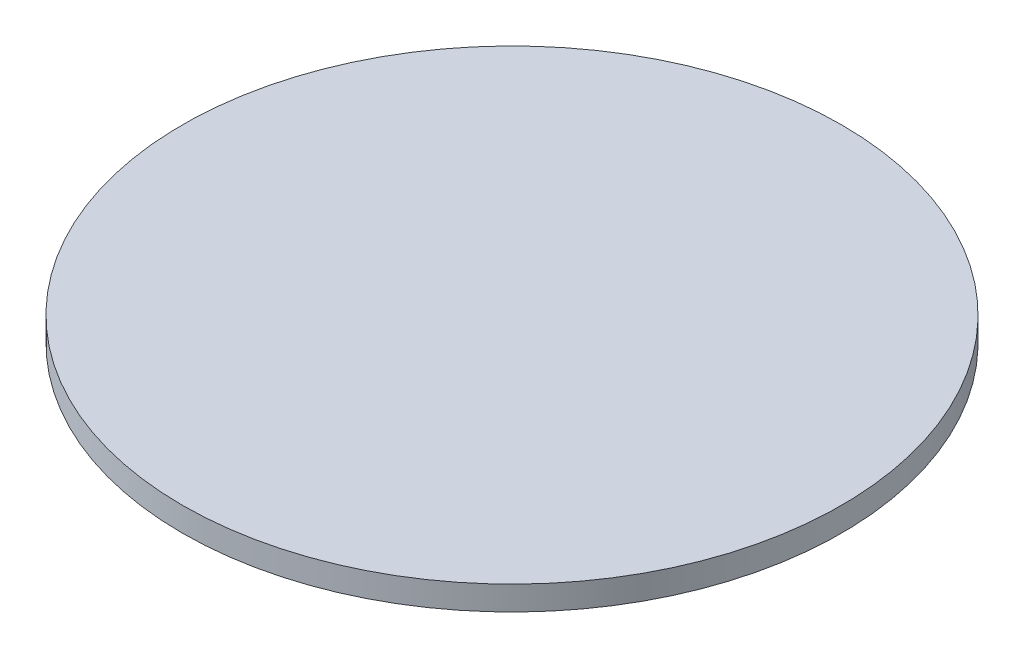
from build123d import *

# Parameters (mm, degrees)
SKETCH1_R           = 15
BOSS_EXTRUDE1_DEPTH = 1.1


with BuildPart() as part:
    # Sketch1 → Boss-Extrude1 (new body)
    with BuildSketch(Plane(origin=(0, 0, 0), x_dir=(1, 0, 0), z_dir=(0, 1, 0))):
        with Locations(Location((0, 0, 0), (0, 0, 270))):
            Circle(SKETCH1_R)
    extrude(amount=BOSS_EXTRUDE1_DEPTH)


solid = part.part
